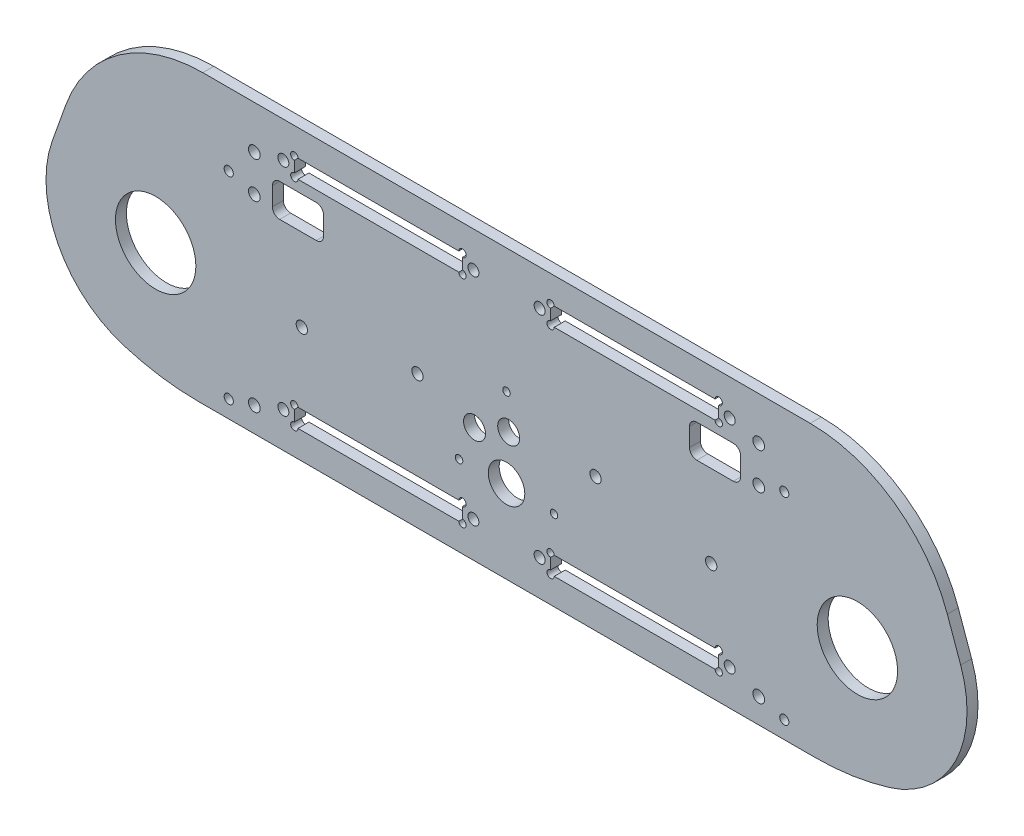
from build123d import *

# Parameters (mm, degrees)
EXTRUDE_1_DEPTH     = 3
SKETCH_2_R          = 1.55
SKETCH_2_R_2        = 11
SKETCH_2_R_3        = 1.25
SKETCH_2_R_4        = 5
SKETCH_2_R_5        = 1.6
CUT_EXTRUDE_1_DEPTH = 130.55693729
EXTRUDE_START       = -3
EXTRUDE_2_DEPTH     = 3
SKETCH_3_R          = 1.5
SKETCH_3_R_2        = 1.6
SKETCH_3_W          = 46
SKETCH_3_H          = 5
CUT_EXTRUDE_2_DEPTH = 135.433749111
SKETCH_5_R          = 1
CUT_EXTRUDE_3_DEPTH = 135.433749111
SKETCH_6_R          = 3
SKETCH_6_R_2        = 1.025
CUT_EXTRUDE_4_DEPTH = 135.433749111
SKETCH_7_W          = 14
SKETCH_7_H          = 9
CUT_EXTRUDE_5_DEPTH = 135.433749111
FILLET_1_R          = 2


with BuildPart() as part:
    # ｽｹｯﾁ1 → ﾎﾞｽ - 押し出し1 (new body)
    with BuildSketch(Plane.XY):
        with BuildLine():
            Line((-96, 30), (96, 30))
            ThreePointArc((96, 30), (126, 0), (96, -30))
            Line((96, -30), (-96, -30))
            ThreePointArc((-96, -30), (-126, 0), (-96, 30))
        make_face()
    extrude(amount=EXTRUDE_1_DEPTH)

    # ｽｹｯﾁ2 → ｶｯﾄ - 押し出し1 (cut, through all)
    with BuildSketch(Plane.XY.offset(3)):
        with Locations((-24.362267564, 4.80144627)):
            Circle(SKETCH_2_R)
        with Locations((-56, 0)):
            Circle(SKETCH_2_R)
        with Locations((-96, 0)):
            Circle(SKETCH_2_R_2)
        with Locations(Location((24.362267564, 4.80144627, 0), (0, 0, 180))):
            Circle(SKETCH_2_R)
        with Locations(Location((56, 0, 0), (0, 0, 180))):
            Circle(SKETCH_2_R)
        with Locations(Location((96, 0, 0), (0, 0, 180))):
            Circle(SKETCH_2_R_2)
        with Locations((-76, 27)):
            Circle(SKETCH_2_R_3)
        with Locations((-76, -27)):
            Circle(SKETCH_2_R_3)
        with Locations(Location((76, 27, 0), (0, 0, 180))):
            Circle(SKETCH_2_R_3)
        with Locations(Location((76, -27, 0), (0, 0, 180))):
            Circle(SKETCH_2_R_3)
        with Locations((0, -9)):
            Circle(SKETCH_2_R_4)
        with Locations((-69, 25)):
            Circle(SKETCH_2_R_5)
        with Locations(Location((-69, -25, 0), (0, 0, 180))):
            Circle(SKETCH_2_R_5)
        with Locations((69, -25)):
            Circle(SKETCH_2_R_5)
        with Locations(Location((69, 25, 0), (0, 0, 180))):
            Circle(SKETCH_2_R_5)
    extrude(amount=-CUT_EXTRUDE_1_DEPTH, mode=Mode.SUBTRACT)

    # ｽｹｯﾁ4 → ﾎﾞｽ - 押し出し2 (add)
    with BuildSketch(Plane.XY.offset(3).offset(EXTRUDE_START)):
        with BuildLine():
            Line((-124.26065672, 10.06654269), (-120.611311687, 20.311657664))
            ThreePointArc((-120.611311687, 20.311657664), (-106.051810297, 39.489926307), (-83.1, 46.77))
            Line((-83.1, 46.77), (83.1, 46.77))
            ThreePointArc((83.1, 46.77), (106.051810297, 39.489926307), (120.611311687, 20.311657664))
            Line((120.611311687, 20.311657664), (124.26065672, 10.06654269))
            ThreePointArc((124.26065672, 10.06654269), (113.291670239, 24.515263416), (96, 30))
            Line((96, 30), (-96, 30))
            ThreePointArc((-96, 30), (-113.291670239, 24.515263416), (-124.26065672, 10.06654269))
        make_face()
        with BuildLine():
            Line((-84.297970262, -31.75), (84.297970262, -31.75))
            ThreePointArc((84.297970262, -31.75), (94.651109882, -30.980141557), (104.776522304, -28.6875))
            ThreePointArc((104.776522304, -28.6875), (100.437059837, -29.670060667), (96, -30))
            Line((96, -30), (-96, -30))
            ThreePointArc((-96, -30), (-100.437059837, -29.670060667), (-104.776522304, -28.6875))
            ThreePointArc((-104.776522304, -28.6875), (-94.651109882, -30.980141557), (-84.297970262, -31.75))
        make_face()
    extrude(amount=EXTRUDE_2_DEPTH)

    # ｽｹｯﾁ3 → ｶｯﾄ - 押し出し2 (cut, through all)
    with BuildSketch(Plane.XY.offset(3)):
        with Locations((-61.057299255, 37.02)):
            Circle(SKETCH_3_R)
        with Locations(Location((-9.057299255, 37.02, 0), (0, 0, 180))):
            Circle(SKETCH_3_R)
        with Locations((9.057299255, 37.02)):
            Circle(SKETCH_3_R)
        with Locations(Location((61.057299255, 37.02, 0), (0, 0, 180))):
            Circle(SKETCH_3_R)
        with Locations((-69, 35)):
            Circle(SKETCH_3_R_2)
        with Locations((61.057299255, -22)):
            Circle(SKETCH_3_R)
        with Locations(Location((9.057299255, -22, 0), (0, 0, 180))):
            Circle(SKETCH_3_R)
        with Locations((-9.057299255, -22)):
            Circle(SKETCH_3_R)
        with Locations(Location((-61.057299255, -22, 0), (0, 0, 180))):
            Circle(SKETCH_3_R)
        with Locations(Location((69, 35, 0), (0, 0, 180))):
            Circle(SKETCH_3_R_2)
        with Locations((-35.057299255, 37.02)):
            Rectangle(SKETCH_3_W, SKETCH_3_H)
        with Locations((35.057299255, 37.02)):
            Rectangle(SKETCH_3_W, SKETCH_3_H)
        with Locations((35.057299255, -22)):
            Rectangle(SKETCH_3_W, SKETCH_3_H)
        with Locations((-35.057299255, -22)):
            Rectangle(SKETCH_3_W, SKETCH_3_H)
    extrude(amount=-CUT_EXTRUDE_2_DEPTH, mode=Mode.SUBTRACT)

    # ｽｹｯﾁ5 → ｶｯﾄ - 押し出し3 (cut, through all)
    with BuildSketch(Plane.XY.offset(3)):
        with Locations((-58.057299255, 39.52)):
            Circle(SKETCH_5_R)
        with Locations((-58.057299255, 34.52)):
            Circle(SKETCH_5_R)
        with Locations((-12.057299255, 39.52)):
            Circle(SKETCH_5_R)
        with Locations((-12.057299255, 34.52)):
            Circle(SKETCH_5_R)
        with Locations((-12.057299255, -19.5)):
            Circle(SKETCH_5_R)
        with Locations((-12.057299255, -24.5)):
            Circle(SKETCH_5_R)
        with Locations((-58.057299255, -19.5)):
            Circle(SKETCH_5_R)
        with Locations((-58.057299255, -24.5)):
            Circle(SKETCH_5_R)
        with Locations((58.057299255, -24.5)):
            Circle(SKETCH_5_R)
        with Locations((58.057299255, -19.5)):
            Circle(SKETCH_5_R)
        with Locations((12.057299255, -24.5)):
            Circle(SKETCH_5_R)
        with Locations((12.057299255, -19.5)):
            Circle(SKETCH_5_R)
        with Locations((12.057299255, 34.52)):
            Circle(SKETCH_5_R)
        with Locations((12.057299255, 39.52)):
            Circle(SKETCH_5_R)
        with Locations((58.057299255, 34.52)):
            Circle(SKETCH_5_R)
        with Locations((58.057299255, 39.52)):
            Circle(SKETCH_5_R)
    extrude(amount=-CUT_EXTRUDE_3_DEPTH, mode=Mode.SUBTRACT)

    # ｽｹｯﾁ6 → ｶｯﾄ - 押し出し4 (cut, through all)
    with BuildSketch(Plane.XY.offset(3)):
        with Locations((-8.749968889, -0.143333333)):
            Circle(SKETCH_6_R)
        with Locations((0.587451619, 3.436132863)):
            Circle(SKETCH_6_R)
        with Locations((-12.990381057, -9.75)):
            Circle(SKETCH_6_R_2)
        with Locations((0, 12.75)):
            Circle(SKETCH_6_R_2)
        with Locations((12.990381057, -9.75)):
            Circle(SKETCH_6_R_2)
    extrude(amount=-CUT_EXTRUDE_4_DEPTH, mode=Mode.SUBTRACT)

    # ｽｹｯﾁ7 → ｶｯﾄ - 押し出し5 (cut, through all)
    with BuildSketch(Plane.XY.offset(3)):
        with Locations((-57.057299255, 27.02)):
            Rectangle(SKETCH_7_W, SKETCH_7_H)
        with Locations((57.057299255, 27.02)):
            Rectangle(SKETCH_7_W, SKETCH_7_H)
    extrude(amount=-CUT_EXTRUDE_5_DEPTH, mode=Mode.SUBTRACT)

    # ﾌｨﾚｯﾄ1
    fillet_1_edges = [part.edges().sort_by_distance(p)[0] for p in [
        (-64.057299255, 22.52, 1.5),
        (-64.057299255, 31.52, 1.5),
        (-50.057299255, 31.52, 1.5),
        (-50.057299255, 22.52, 1.5),
        (50.057299255, 22.52, 1.5),
        (50.057299255, 31.52, 1.5),
        (64.057299255, 31.52, 1.5),
        (64.057299255, 22.52, 1.5),
    ]]
    fillet(fillet_1_edges, radius=FILLET_1_R)


solid = part.part
